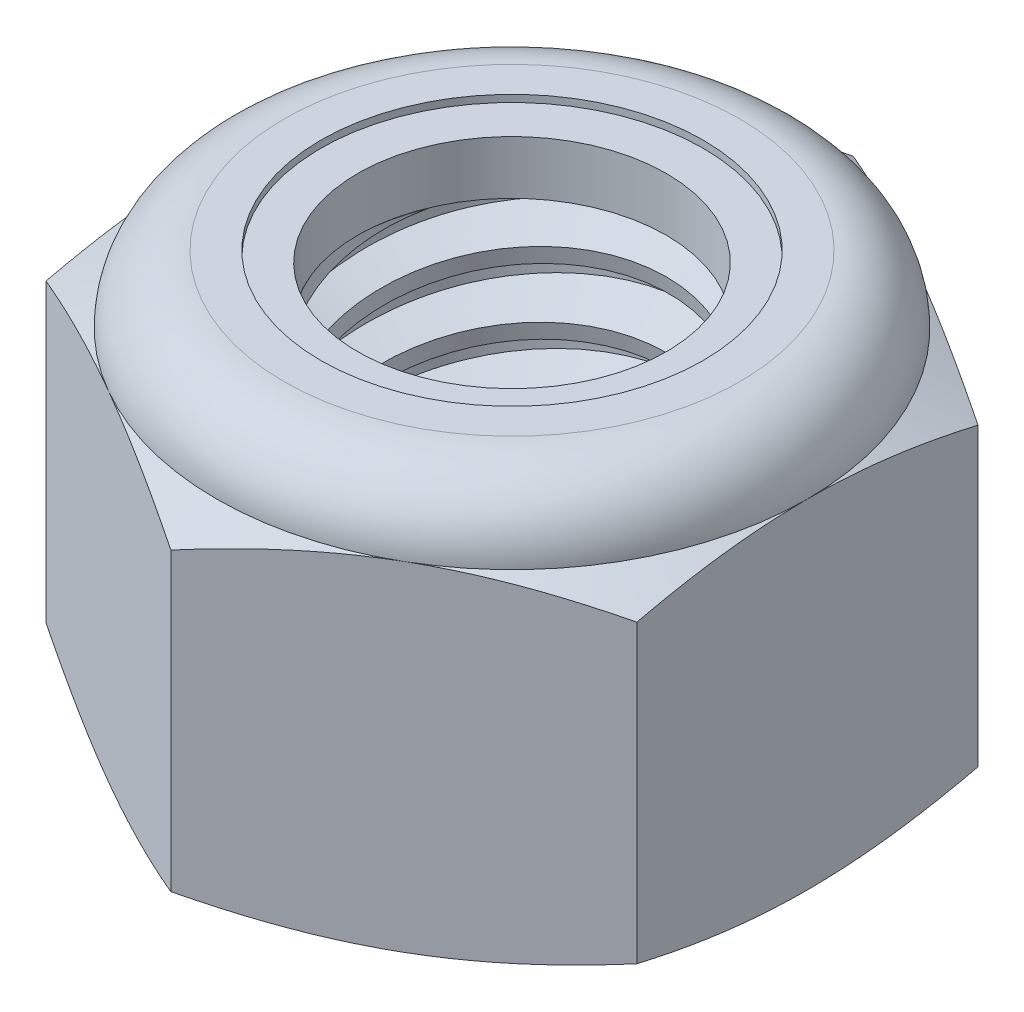
from build123d import *

# Parameters (mm, degrees)
EXTRUDE1_DEPTH      = 8.73125
SKETCH2_W           = 3.9624
SKETCH2_H           = 8.73125
LPATTERN1_COUNT     = 6
LPATTERN1_PITCH     = 1.411111111
LPATTERN1_COL_COUNT = 2
LPATTERN1_COL_PITCH = 1.411111111


with BuildPart() as part:
    # Sketch1 → Extrude1 (new body)
    with BuildSketch(Plane(origin=(0, 0, 0), x_dir=(1, 0, 0), z_dir=(0, 1, 0))):
        Polygon((0, 7.332348419), (-6.35, 3.666174209), (-6.35, -3.666174209), (0, -7.332348419), (6.35, -3.666174209), (6.35, 3.666174209), align=None)
    extrude(amount=EXTRUDE1_DEPTH)

    # Sketch4 → Cut-Revolve2 (revolve, cut)
    with BuildSketch(Plane(origin=(0, 0, 0), x_dir=(0, 0, -1), z_dir=(1, 0, 0)), mode=Mode.PRIVATE) as cut_revolve2_sk:
        Polygon((0, 8.73125), (3.9624, 8.73125), (3.318668226, 8.431072944), (3.318668226, 0.300177056), (3.9624, 0), (0, 0), align=None)
    revolve(cut_revolve2_sk.sketch.rotate(Axis((0, 8.73125, 0), (0, 1, 0)), 54.613905467), axis=Axis((0, 8.73125, 0), (0, 1, 0)), mode=Mode.SUBTRACT)


with BuildPart() as body_2:
    # Sketch2 → Revolve1 (revolve)
    with BuildSketch(Plane(origin=(0, 0, 0), x_dir=(0, 0, -1), z_dir=(1, 0, 0))):
        with Locations((1.9812, 4.365625)):
            Rectangle(SKETCH2_W, SKETCH2_H)
    revolve(axis=Axis((0, -3.9624, 0), (0, 1, 0)))

    # Sketch3 → Cut-Revolve1 (revolve, cut)
    with BuildSketch(Plane(origin=(0, 0, 0), x_dir=(0, 0, -1), z_dir=(1, 0, 0)), mode=Mode.PRIVATE) as cut_revolve1_sk:
        Polygon((3.993321894, 8.557592646), (4.209775148, 7.341991167), (3.380512014, 7.642238826), (3.318668226, 7.989553534), align=None)
    cut_revolve1 = revolve(cut_revolve1_sk.sketch.rotate(Axis((0, 8.73125, 0.26919352), (0, -0.9845141333311523, -0.17530522317150174)), 180), axis=Axis((0, 8.73125, 0.26919352), (0, -0.9845141333311523, -0.17530522317150174)), mode=Mode.SUBTRACT)

    # LPattern1: Cut-Revolve1 ×6
    with Locations(*[(0, -i * LPATTERN1_PITCH, 0) for i in range(1, LPATTERN1_COUNT)]):
        add(cut_revolve1, mode=Mode.SUBTRACT)

    # LPattern1 col: Cut-Revolve1 ×2
    with Locations(*[(0, i * LPATTERN1_COL_PITCH, 0) for i in range(1, LPATTERN1_COL_COUNT)]):
        add(cut_revolve1, mode=Mode.SUBTRACT)


with BuildPart() as part_1:
    add(part.part)

    # Combine1: cut body 2
    add(body_2.part, mode=Mode.SUBTRACT)

    # Sketch5 → Cut-Revolve3 (revolve, cut)
    with BuildSketch(Plane(origin=(0, 0, 0), x_dir=(0, 0, -1), z_dir=(1, 0, 0)), mode=Mode.PRIVATE) as cut_revolve3_sk:
        with BuildLine():
            Line((0, 0), (6.35, 0))
            Line((6.35, 0), (7.332348419, 0.458076591))
            Line((7.332348419, 0.458076591), (7.332348419, 6.817965076))
            Line((7.332348419, 6.817965076), (6.35, 7.276041667))
            ThreePointArc((6.35, 7.276041667), (5.923779347, 8.305029347), (4.894791667, 8.73125))
            Line((4.894791667, 8.73125), (4.894791667, 10.00125))
            Line((4.894791667, 10.00125), (8.602348419, 10.00125))
            Line((8.602348419, 10.00125), (8.602348419, -1.27))
            Line((8.602348419, -1.27), (0, -1.27))
            Line((0, -1.27), (0, 0))
        make_face()
    revolve(cut_revolve3_sk.sketch.rotate(Axis((0, 0, 0), (0, 1, 0)), 54.613905467), axis=Axis((0, 0, 0), (0, 1, 0)), mode=Mode.SUBTRACT)

    # Sketch6 → Cut-Revolve4 (revolve, cut)
    with BuildSketch(Plane(origin=(0, 0, 0), x_dir=(0, 0, -1), z_dir=(1, 0, 0)), mode=Mode.PRIVATE) as cut_revolve4_sk:
        with BuildLine():
            Line((0, 7.276041667), (6.1976, 7.276041667))
            ThreePointArc((6.1976, 7.276041667), (5.816016274, 8.197266274), (4.894791667, 8.57885))
            Line((4.894791667, 8.57885), (4.106729947, 8.57885))
            Line((4.106729947, 8.57885), (4.106729947, 10.00125))
            Line((4.106729947, 10.00125), (0, 10.00125))
            Line((0, 10.00125), (0, 7.276041667))
        make_face()
    revolve(cut_revolve4_sk.sketch.rotate(Axis((0, 10.00125, 0), (0, 1, 0)), 54.613905467), axis=Axis((0, 10.00125, 0), (0, 1, 0)), mode=Mode.SUBTRACT)


with BuildPart() as body_2_2:
    # Sketch7 → Revolve2 (revolve)
    with BuildSketch(Plane(origin=(0, 0, 0), x_dir=(0, 0, -1), z_dir=(1, 0, 0))):
        with BuildLine():
            Line((3.318668226, 7.352241667), (6.119030844, 7.352241667))
            ThreePointArc((6.119030844, 7.352241667), (5.734762038, 8.169919611), (4.894791667, 8.50265))
            Line((4.894791667, 8.50265), (3.318668226, 8.50265))
            Line((3.318668226, 8.50265), (3.318668226, 7.352241667))
        make_face()
    revolve(axis=Axis((0, 7.352241667, 0), (0, 1, 0)))


solid = Compound([part_1.part, body_2_2.part])
